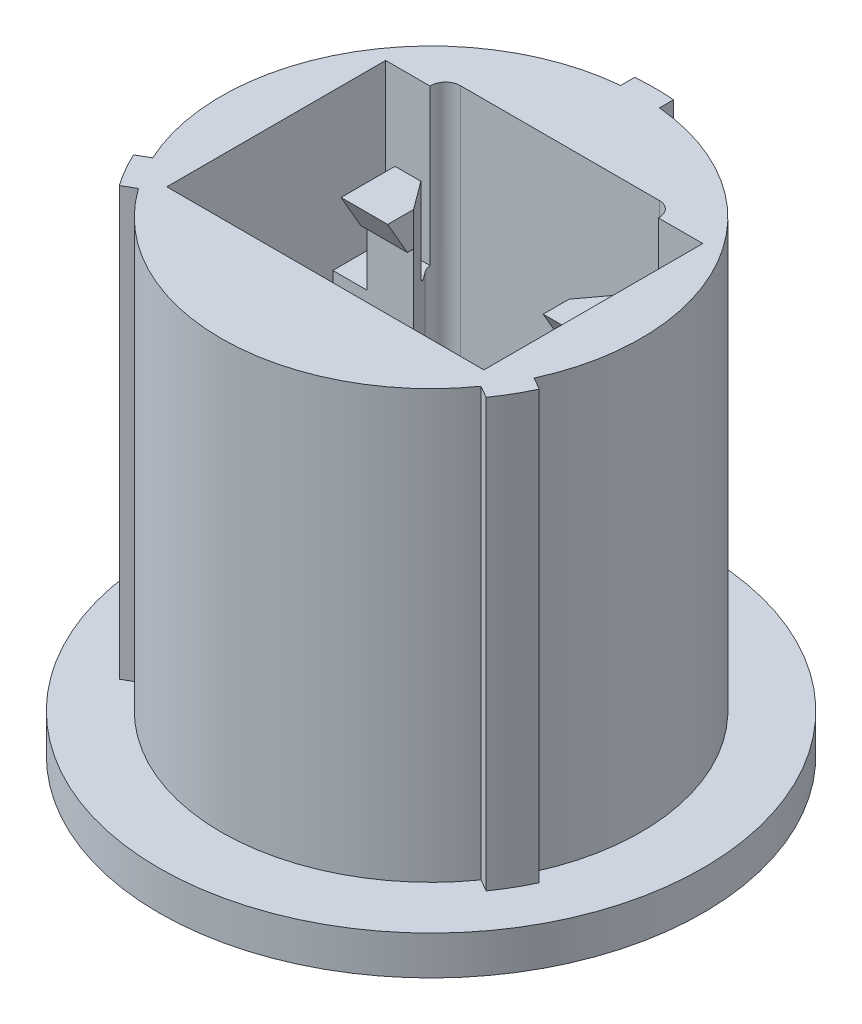
from build123d import *

# Parameters (mm, degrees)
BOSS_EXTRUDE1_DEPTH  = 19.05
CUT_EXTRUDE1_DEPTH   = 23.803574111
CUT_EXTRUDE2_DEPTH   = 18.25625
SKETCH6_W            = 0.608326788
SKETCH6_H            = 1.5875
SKETCH8_W            = 2.576826788
SKETCH8_H            = 1.5875
SKETCH9_W            = 12.954
SKETCH9_H            = 5.08
SKETCH9_H_2          = 2.159
CUT_EXTRUDE3_DEPTH   = 6.35
BOSS_EXTRUDE2_DEPTH  = 2.54
SKETCH11_W           = 1.905
SKETCH11_H           = 0.127
BOSS_EXTRUDE3_DEPTH  = 0.254
FILLET1_R            = 0.508
FILLET2_R            = 0.0635
BOSS_EXTRUDE4_DEPTH  = 1.27
BOSS_EXTRUDE5_DEPTH  = 1.905
FILLET1_OF_MIRROR1_R = 0.508


with BuildPart() as part:
    # Sketch1 → Boss-Extrude1 (new body)
    with BuildSketch(Plane(origin=(0, 0, 0), x_dir=(1, 0, 0), z_dir=(0, 1, 0))):
        with BuildLine():
            Line((-0.79375, 9.109483901), (-0.79375, 8.535673212))
            ThreePointArc((-0.79375, 8.535673212), (-7.424002774, 4.28625), (-7.78898484, -3.580428942))
            Line((-7.78898484, -3.580428942), (-8.285919473, -3.867334286))
            ThreePointArc((-8.285919473, -3.867334286), (-7.918936292, -4.572), (-7.492169473, -5.242149615))
            Line((-7.492169473, -5.242149615), (-6.99523484, -4.95524427))
            ThreePointArc((-6.99523484, -4.95524427), (0, -8.5725), (6.99523484, -4.95524427))
            Line((6.99523484, -4.95524427), (7.492169473, -5.242149615))
            ThreePointArc((7.492169473, -5.242149615), (7.918936292, -4.572), (8.285919473, -3.867334286))
            Line((8.285919473, -3.867334286), (7.78898484, -3.580428942))
            ThreePointArc((7.78898484, -3.580428942), (7.424002774, 4.28625), (0.79375, 8.535673212))
            Line((0.79375, 8.535673212), (0.79375, 9.109483901))
            ThreePointArc((0.79375, 9.109483901), (0, 9.144), (-0.79375, 9.109483901))
        make_face()
    extrude(amount=BOSS_EXTRUDE1_DEPTH)

    # Sketch2 → Cut-Extrude1 (cut, through all)
    with BuildSketch(Plane(origin=(0, 19.05, 0), x_dir=(1, 0, 0), z_dir=(0, 1, 0))):
        with BuildLine():
            Line((-4.543615348, 4.303093955), (-3.175, 2.4638))
            Line((-3.175, 2.4638), (3.175, 2.4638))
            Line((3.175, 2.4638), (4.543615348, 4.303093955))
            ThreePointArc((4.543615348, 4.303093955), (4.598203733, 4.928342625), (4.064, 5.2578))
            Line((4.064, 5.2578), (-4.064, 5.2578))
            ThreePointArc((-4.064, 5.2578), (-4.598203733, 4.928342625), (-4.543615348, 4.303093955))
        make_face()
    extrude(amount=-CUT_EXTRUDE1_DEPTH, mode=Mode.SUBTRACT)

    # Sketch2<4> → Cut-Extrude2 (cut)
    with BuildSketch(Plane(origin=(0, 19.05, 0), x_dir=(1, 0, 0), z_dir=(0, 1, 0))):
        Polygon((3.175, 2.4638), (-3.175, 2.4638), (-6.477, 2.4638), (-6.477, 0.762), (6.477, 0.762), (6.477, 2.4638), align=None)
    extrude(amount=-CUT_EXTRUDE2_DEPTH, mode=Mode.SUBTRACT)

    # Sketch6 → Cut-Revolve2 (revolve, cut)
    with BuildSketch(Plane(origin=(0, 0, 0), x_dir=(0, 0, -1), z_dir=(1, 0, 0))):
        with Locations((8.839836606, 0.79375)):
            Rectangle(SKETCH6_W, SKETCH6_H)
    revolve(axis=Axis((0, 19.730213777, 0), (0, -1, 0)), mode=Mode.SUBTRACT)

    # Sketch8 → Revolve2 (revolve)
    with BuildSketch(Plane(origin=(0, 0, 0), x_dir=(0, 0, -1), z_dir=(1, 0, 0))):
        with Locations((9.824086606, 0.79375)):
            Rectangle(SKETCH8_W, SKETCH8_H)
    revolve(axis=Axis((0, 4.48386458, 0), (0, -1, 0)))

    # Sketch9 → Cut-Extrude3 (cut)
    with BuildSketch(Plane(origin=(0, 19.05, 0), x_dir=(1, 0, 0), z_dir=(0, 1, 0))):
        with Locations((0, -1.778)):
            Rectangle(SKETCH9_W, SKETCH9_H)
        with Locations((0, 3.5433)):
            Rectangle(SKETCH9_W, SKETCH9_H_2)
    extrude(amount=-CUT_EXTRUDE3_DEPTH, mode=Mode.SUBTRACT)

    # Sketch10 → Boss-Extrude2 (add)
    with BuildSketch(Plane(origin=(0, 12.7, 0), x_dir=(1, 0, 0), z_dir=(0, 1, 0))):
        Polygon((-3.175, 2.4638), (-4.025504259, 3.6068), (-5.08, 3.6068), (-5.08, 2.4638), align=None)
    boss_extrude2 = extrude(amount=BOSS_EXTRUDE2_DEPTH)

    # Sketch11 → Boss-Extrude3 (add)
    with BuildSketch(Plane.XY.offset(-2.4638)):
        with Locations((-4.1275, 15.1765)):
            Rectangle(SKETCH11_W, SKETCH11_H)
    boss_extrude3 = extrude(amount=BOSS_EXTRUDE3_DEPTH)

    # Fillet1
    fillet1_edges = [part.edges().sort_by_distance(p)[0] for p in [
        (-4.55275213, 12.7, -3.6068),
    ]]
    fillet(fillet1_edges, radius=FILLET1_R)

    # Fillet2
    fillet2_edges = [part.edges().sort_by_distance(p)[0] for p in [
        (-4.1275, 15.113, -2.4638),
    ]]
    fillet(fillet2_edges, radius=FILLET2_R)

    # Sketch12 → Boss-Extrude4 (add)
    with BuildSketch(Plane(origin=(0, 15.24, 0), x_dir=(1, 0, 0), z_dir=(0, 1, 0))):
        Polygon((-3.175, 2.2098), (-3.175, 2.4638), (-4.025504259, 3.6068), (-5.08, 3.6068), (-5.08, 2.2098), align=None)
    boss_extrude4 = extrude(amount=BOSS_EXTRUDE4_DEPTH)

    # Sketch13 → Boss-Extrude5 (add)
    with BuildSketch(Plane(origin=(-3.175, 0, 0), x_dir=(0, 0, -1), z_dir=(1, 0, 0))):
        Polygon((2.2098, 15.113), (1.403241674, 16.51), (2.2098, 16.51), align=None)
    boss_extrude5 = extrude(amount=-BOSS_EXTRUDE5_DEPTH)

    # Mirror1: Boss-Extrude2, Boss-Extrude3, Boss-Extrude4, Boss-Extrude5 across plane
    add(boss_extrude2.mirror(Plane(origin=(0, 0, 0), x_dir=(0, 0, 1), z_dir=(1, 0, 0))))
    add(boss_extrude3.mirror(Plane(origin=(0, 0, 0), x_dir=(0, 0, 1), z_dir=(1, 0, 0))))
    add(boss_extrude4.mirror(Plane(origin=(0, 0, 0), x_dir=(0, 0, 1), z_dir=(1, 0, 0))))
    add(boss_extrude5.mirror(Plane(origin=(0, 0, 0), x_dir=(0, 0, 1), z_dir=(1, 0, 0))))

    # Fillet1 of Mirror1
    fillet1_of_mirror1_edges = [part.edges().sort_by_distance(p)[0] for p in [
        (4.55275213, 12.7, -3.6068),
    ]]
    fillet(fillet1_of_mirror1_edges, radius=FILLET1_OF_MIRROR1_R)


solid = part.part
